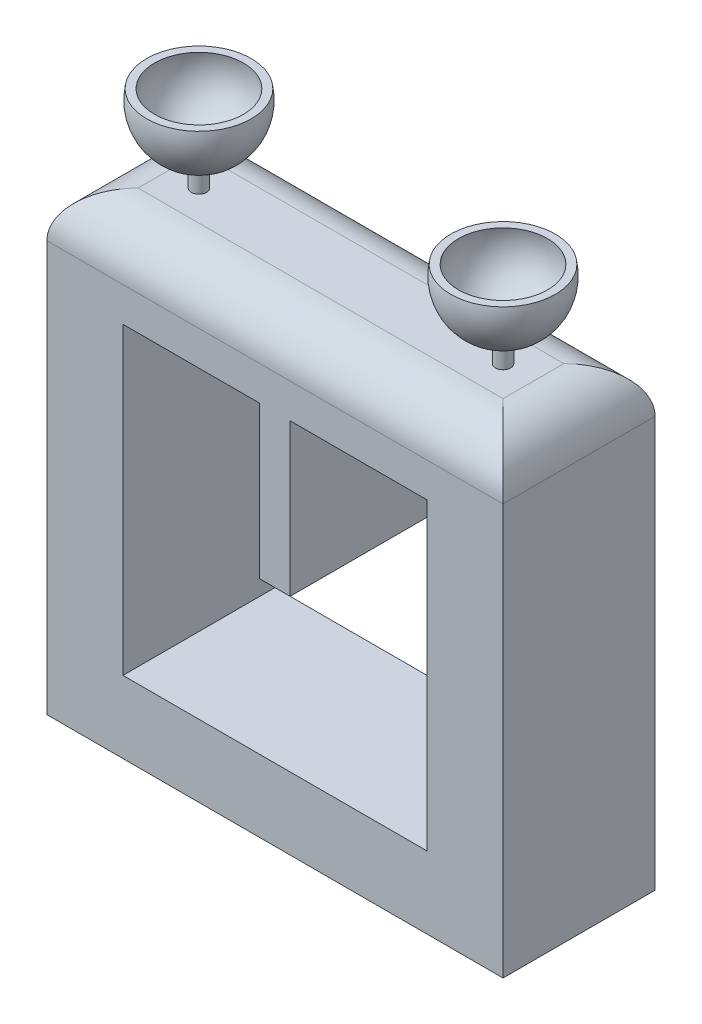
from build123d import *

# Parameters (mm, degrees)
SKETCH1_W           = 30
SKETCH1_H           = 30
BOSS_EXTRUDE1_DEPTH = 10
FILLET1_R           = 3
SKETCH5_W           = 20
SKETCH5_H           = 20
CUT_EXTRUDE1_DEPTH  = 21
SKETCH6_R           = 0.5
BOSS_EXTRUDE4_DEPTH = 2
SKETCH9_W           = 2
SKETCH9_H           = 10
BOSS_EXTRUDE6_DEPTH = 10


with BuildPart() as part:
    # Sketch1 → Boss-Extrude1 (new body)
    with BuildSketch(Plane.XY):
        with Locations((15, 15)):
            Rectangle(SKETCH1_W, SKETCH1_H)
    extrude(amount=BOSS_EXTRUDE1_DEPTH)

    # Fillet1
    fillet1_edges = [part.edges().sort_by_distance(p)[0] for p in [
        (15, 30, 10),
        (15, 30, 0),
        (0, 30, 5),
        (30, 30, 5),
    ]]
    fillet(fillet1_edges, radius=FILLET1_R)

    # Sketch5 → Cut-Extrude1 (cut)
    with BuildSketch(Plane(origin=(0, 0, 0), x_dir=(-1, 0, 0), z_dir=(0, 0, -1))):
        with Locations((-15, 14.738245614)):
            Rectangle(SKETCH5_W, SKETCH5_H)
    extrude(amount=-CUT_EXTRUDE1_DEPTH, mode=Mode.SUBTRACT)

    # Sketch6 → Boss-Extrude4 (add)
    with BuildSketch(Plane(origin=(0, 30, 0), x_dir=(1, 0, 0), z_dir=(0, 1, 0))):
        with Locations(Location((5, -5, 0), (0, 0, 90))):
            Circle(SKETCH6_R)
    boss_extrude4 = extrude(amount=BOSS_EXTRUDE4_DEPTH)

    # Sketch7 → Revolve1 (revolve)
    with BuildSketch(Plane.ZY.offset(-5)):
        with BuildLine():
            Line((5, 32), (5, 31.5))
            ThreePointArc((5, 31.5), (7.698400535, 32.770956583), (8.437058256, 35.660780255))
            Line((8.437058256, 35.660780255), (7.926323539, 35.660780255))
            ThreePointArc((7.926323539, 35.660780255), (7.343324643, 33.126812979), (5, 32))
        make_face()
    revolve1 = revolve(axis=Axis((5, 32, 5), (0, -1, 0)))

    # Mirror3: Boss-Extrude4, Revolve1 across plane
    add(boss_extrude4.mirror(Plane.ZY.offset(-15)))
    add(revolve1.mirror(Plane.ZY.offset(-15)))

    # Sketch9 → Boss-Extrude6 (add)
    with BuildSketch(Plane.XY.offset(10)):
        with Locations((14.994821354, 19.738245614)):
            Rectangle(SKETCH9_W, SKETCH9_H)
    extrude(amount=-BOSS_EXTRUDE6_DEPTH)


solid = part.part
